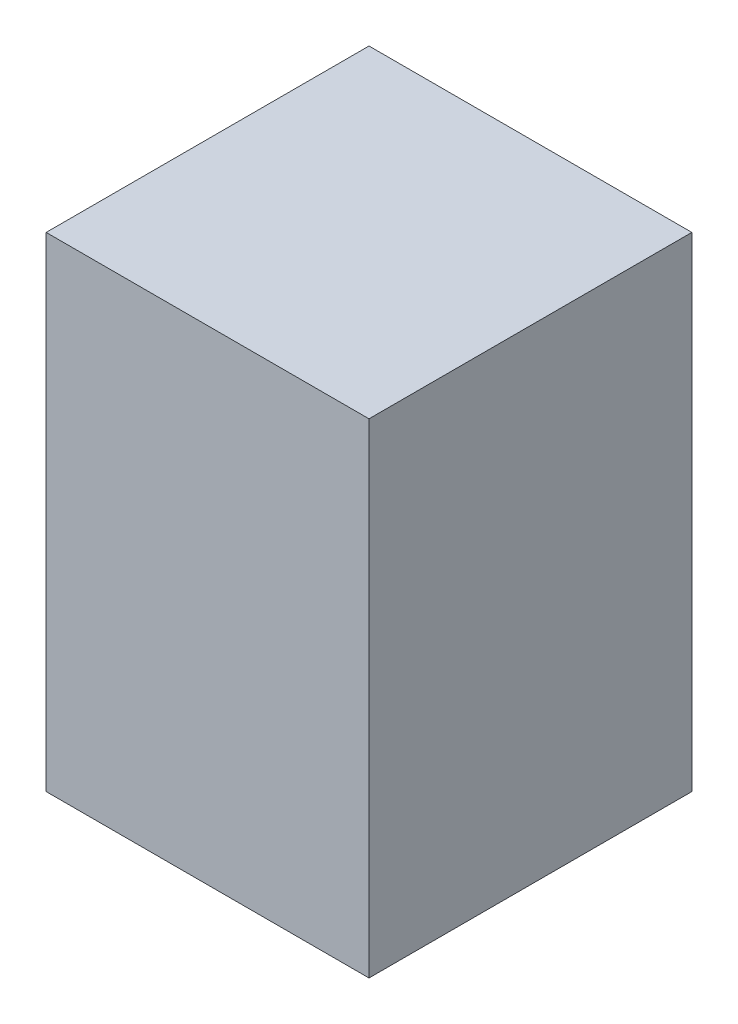
from build123d import *

# Parameters (mm, degrees)
PRESS_AYAK_3_1_START = -680
SKETCH1_W            = 80
SKETCH1_H            = 120
PRESS_AYAK_3_1_DEPTH = 80


with BuildPart() as part:
    # Sketch1 → PRESS_ayak_3_1 (new body)
    with BuildSketch(Plane.XY.offset(PRESS_AYAK_3_1_START)):
        with Locations((100, 60)):
            Rectangle(SKETCH1_W, SKETCH1_H)
    extrude(amount=-PRESS_AYAK_3_1_DEPTH)


solid = part.part
